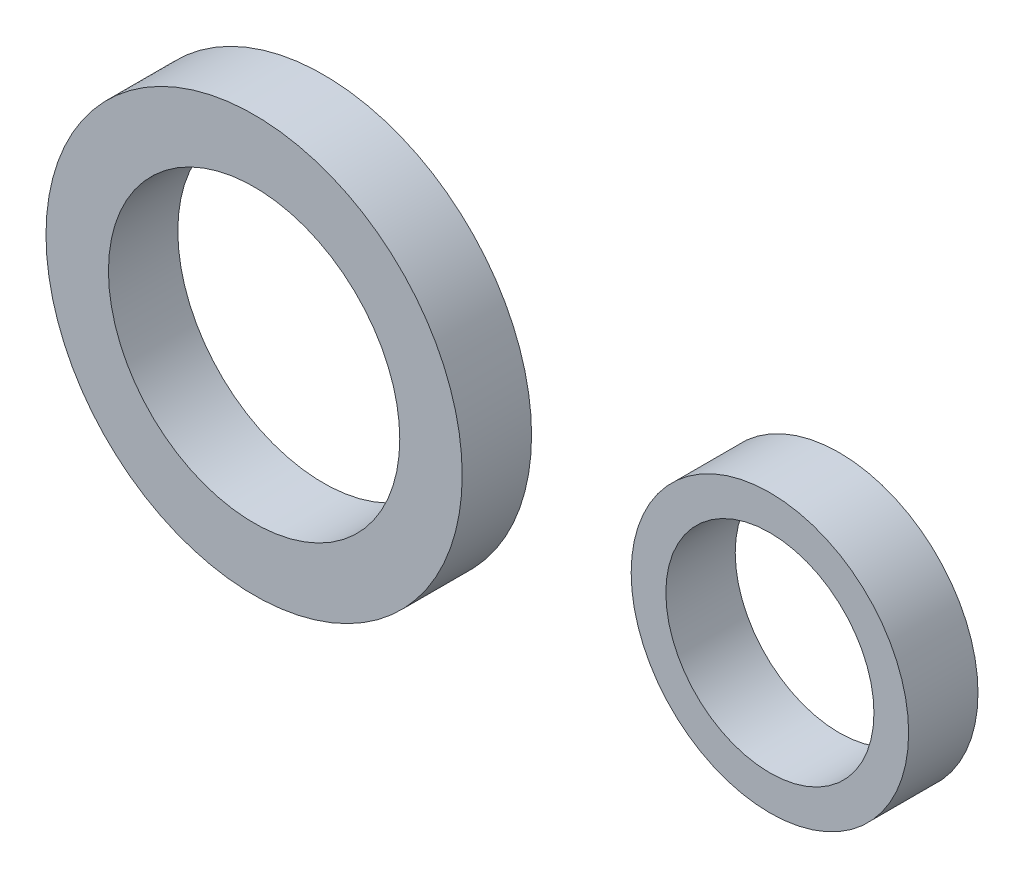
from build123d import *

# Parameters (mm, degrees)
ESQUISSE1_R        = 15
ESQUISSE1_R_2      = 10.5
BOSS_EXTRU_1_DEPTH = 5
ESQUISSE3_R        = 10
ESQUISSE3_R_2      = 7.5
BOSS_EXTRU_2_DEPTH = 5


with BuildPart() as part:
    # Esquisse1 → Boss.-Extru.1 (new body)
    with BuildSketch(Plane.XY):
        Circle(ESQUISSE1_R)
        Circle(ESQUISSE1_R_2, mode=Mode.SUBTRACT)
    extrude(amount=BOSS_EXTRU_1_DEPTH)


with BuildPart() as body_2:
    # Esquisse3 → Boss.-Extru.2 (new body)
    with BuildSketch(Plane.XY):
        with Locations((37.178242291, 0)):
            Circle(ESQUISSE3_R)
        with Locations((37.178242291, 0)):
            Circle(ESQUISSE3_R_2, mode=Mode.SUBTRACT)
    extrude(amount=BOSS_EXTRU_2_DEPTH)


solid = Compound([part.part, body_2.part])
